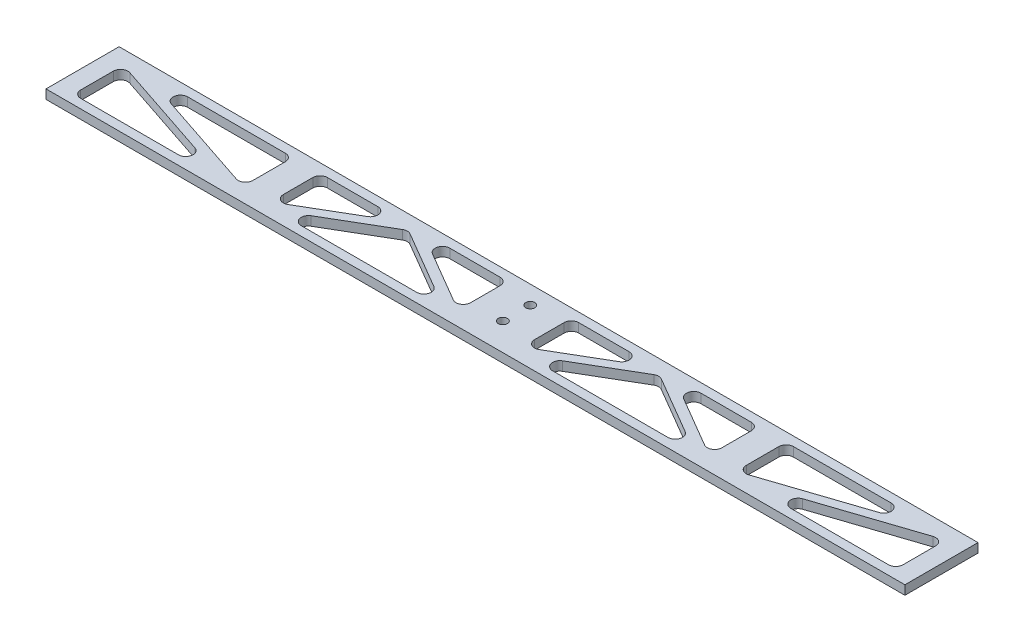
from build123d import *

# Parameters (mm, degrees)
SKETCH1_W           = 298.45
SKETCH1_H           = 25.4
BOSS_EXTRUDE1_DEPTH = 3.175
CUT_EXTRUDE1_DEPTH  = 150.798101623
SKETCH3_R           = 1.5875
CUT_EXTRUDE2_DEPTH  = 150.798101623
FILLET1_R           = 2.54


with BuildPart() as part:
    # Sketch1 → Boss-Extrude1 (new body)
    with BuildSketch(Plane(origin=(0, 0, 0), x_dir=(1, 0, 0), z_dir=(0, 1, 0))):
        Rectangle(SKETCH1_W, SKETCH1_H)
    extrude(amount=BOSS_EXTRUDE1_DEPTH)

    # Sketch2 → Cut-Extrude1 (cut, through all)
    with BuildSketch(Plane(origin=(0, 3.175, 0), x_dir=(1, 0, 0), z_dir=(0, 1, 0))):
        Polygon((-142.875, -9.525), (-90.745115786, -9.525), (-142.875, 7.851628071), align=None)
        Polygon((-85.725, -7.851628071), (-85.725, 9.525), (-137.854884214, 9.525), align=None)
        Polygon((-76.2, -7.685517516), (-46.798699244, 9.525), (-76.2, 9.525), align=None)
        Polygon((-73.057550756, -9.525), (-14.254949244, -9.525), (-43.65625, 7.685517516), align=None)
        Polygon((-11.1125, -7.685517516), (-11.1125, 9.525), (-40.513800756, 9.525), align=None)
        Polygon((11.1125, -7.685517516), (40.513800756, 9.525), (11.1125, 9.525), align=None)
        Polygon((14.254949244, -9.525), (73.057550756, -9.525), (43.65625, 7.685517516), align=None)
        Polygon((76.2, -7.685517516), (76.2, 9.525), (46.798699244, 9.525), align=None)
        Polygon((85.725, -7.851628071), (137.854884214, 9.525), (85.725, 9.525), align=None)
        Polygon((90.745115786, -9.525), (142.875, -9.525), (142.875, 7.851628071), align=None)
    extrude(amount=-CUT_EXTRUDE1_DEPTH, mode=Mode.SUBTRACT)

    # Sketch3 → Cut-Extrude2 (cut, through all)
    with BuildSketch(Plane(origin=(0, 3.175, 0), x_dir=(1, 0, 0), z_dir=(0, 1, 0))):
        with Locations(Location((0, 6.35, 0), (0, 0, 270))):
            Circle(SKETCH3_R)
        with Locations(Location((0, -3.175, 0), (0, 0, 270))):
            Circle(SKETCH3_R)
    extrude(amount=-CUT_EXTRUDE2_DEPTH, mode=Mode.SUBTRACT)

    # Fillet1
    fillet1_edges = [part.edges().sort_by_distance(p)[0] for p in [
        (-43.65625, 1.5875, -7.685517516),
        (-14.254949244, 1.5875, 9.525),
        (-73.057550756, 1.5875, 9.525),
        (-40.513800756, 1.5875, -9.525),
        (-11.1125, 1.5875, -9.525),
        (-11.1125, 1.5875, 7.685517516),
        (-76.2, 1.5875, 7.685517516),
        (-76.2, 1.5875, -9.525),
        (-46.798699244, 1.5875, -9.525),
        (-85.725, 1.5875, 7.851628071),
        (-137.854884214, 1.5875, -9.525),
        (-85.725, 1.5875, -9.525),
        (85.725, 1.5875, 7.851628071),
        (85.725, 1.5875, -9.525),
        (137.854884214, 1.5875, -9.525),
        (46.798699244, 1.5875, -9.525),
        (76.2, 1.5875, -9.525),
        (76.2, 1.5875, 7.685517516),
        (11.1125, 1.5875, 7.685517516),
        (11.1125, 1.5875, -9.525),
        (40.513800756, 1.5875, -9.525),
        (43.65625, 1.5875, -7.685517516),
        (73.057550756, 1.5875, 9.525),
        (14.254949244, 1.5875, 9.525),
        (90.745115786, 1.5875, 9.525),
        (142.875, 1.5875, -7.851628071),
        (142.875, 1.5875, 9.525),
        (-90.745115786, 1.5875, 9.525),
        (-142.875, 1.5875, 9.525),
        (-142.875, 1.5875, -7.851628071),
    ]]
    fillet(fillet1_edges, radius=FILLET1_R)


solid = part.part
